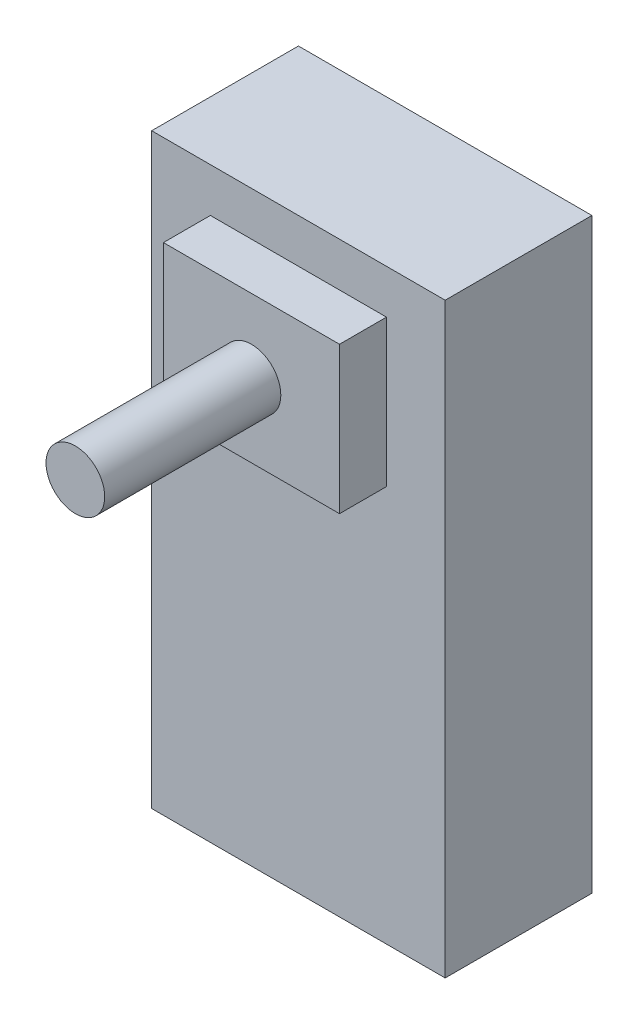
from build123d import *

# Parameters (mm, degrees)
SKETCH2_W           = 50
SKETCH2_H           = 100
BOSS_EXTRUDE1_DEPTH = 25
SKETCH5_W           = 30
SKETCH5_H           = 25
BOSS_EXTRUDE3_DEPTH = 8
SKETCH6_R           = 5
BOSS_EXTRUDE4_DEPTH = 30


with BuildPart() as part:
    # Sketch2 → Boss-Extrude1 (new body)
    with BuildSketch(Plane.XY):
        Rectangle(SKETCH2_W, SKETCH2_H)
    extrude(amount=-BOSS_EXTRUDE1_DEPTH)

    # Sketch5 → Boss-Extrude3 (add)
    with BuildSketch(Plane.XY):
        with Locations((0, 30)):
            Rectangle(SKETCH5_W, SKETCH5_H)
    extrude(amount=BOSS_EXTRUDE3_DEPTH)

    # Sketch6 → Boss-Extrude4 (add)
    with BuildSketch(Plane.XY.offset(8)):
        with Locations((0, 30)):
            Circle(SKETCH6_R)
    extrude(amount=BOSS_EXTRUDE4_DEPTH)


solid = part.part
